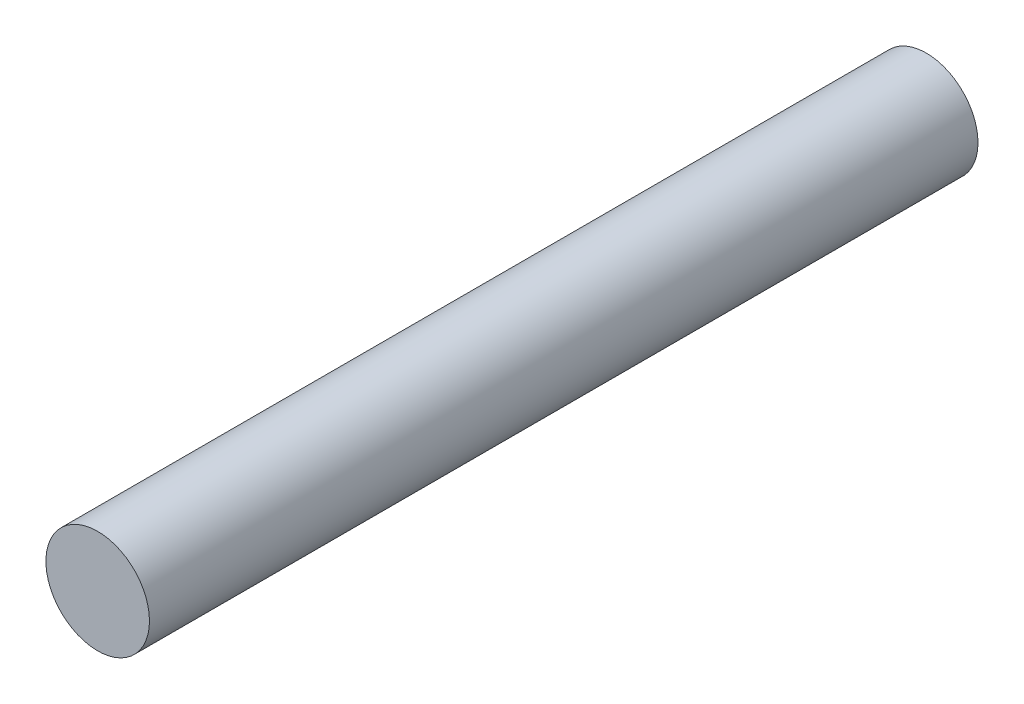
from build123d import *

# Parameters (mm, degrees)
ESBO_O1_R                = 2.5
RESSALTO_EXTRUS_O1_DEPTH = 40


with BuildPart() as part:
    # Esboço1 → Ressalto-extrusão1 (new body)
    with BuildSketch(Plane.XY):
        Circle(ESBO_O1_R)
    extrude(amount=RESSALTO_EXTRUS_O1_DEPTH)


solid = part.part
